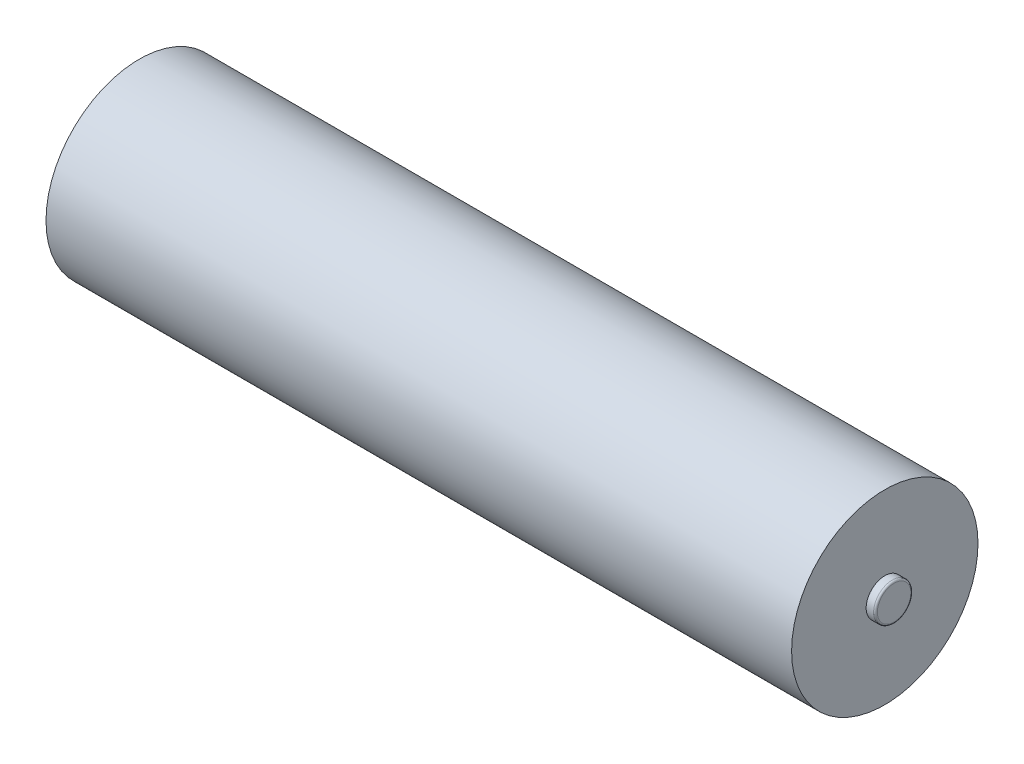
from build123d import *

# Parameters (mm, degrees)
SKETCH1_R            = 50
BOSS_EXTRUDE1_DEPTH  = 200
SKETCH2_R            = 10
BOSS_EXTRUDE2_DEPTH  = 5
FILLET1_R            = 1
FILLET1_OF_MIRROR3_R = 1


with BuildPart() as part:
    # Sketch1 → Boss-Extrude1 (new, symmetric)
    with BuildSketch(Plane(origin=(0, 0, 0), x_dir=(0, 0, -1), z_dir=(1, 0, 0))):
        Circle(SKETCH1_R)
    extrude(amount=BOSS_EXTRUDE1_DEPTH, both=True)

    # Sketch2 → Boss-Extrude2 (add)
    with BuildSketch(Plane(origin=(200, 0, 0), x_dir=(0, 0, -1), z_dir=(1, 0, 0))):
        Circle(SKETCH2_R)
    boss_extrude2 = extrude(amount=BOSS_EXTRUDE2_DEPTH)

    # Fillet1
    fillet1_edges = [part.edges().sort_by_distance(p)[0] for p in [
        (205, 0, 10),
    ]]
    fillet(fillet1_edges, radius=FILLET1_R)

    # Mirror3: Boss-Extrude2 across plane
    add(boss_extrude2.mirror(Plane(origin=(0, 0, 0), x_dir=(0, 0, 1), z_dir=(1, 0, 0))))

    # Fillet1 of Mirror3
    fillet1_of_mirror3_edges = [part.edges().sort_by_distance(p)[0] for p in [
        (-205, 0, 10),
    ]]
    fillet(fillet1_of_mirror3_edges, radius=FILLET1_OF_MIRROR3_R)


solid = part.part
